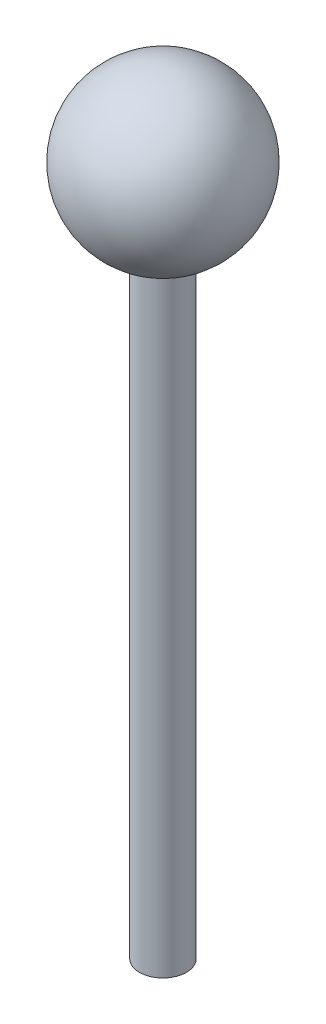
from build123d import *


with BuildPart() as part:
    # Sketch1 → Revolve1 (revolve)
    with BuildSketch(Plane.XY):
        with BuildLine():
            Line((5, -16.770509831), (5, -146.770509831))
            Line((5, -146.770509831), (0, -146.770509831))
            Line((0, -146.770509831), (0, -1.75))
            Line((0, -1.75), (0, 17.5))
            ThreePointArc((0, 17.5), (17.316667145, 2.526467688), (5, -16.770509831))
        make_face()
    revolve(axis=Axis((0, -1000, 0), (0, 1, 0)))


solid = part.part
